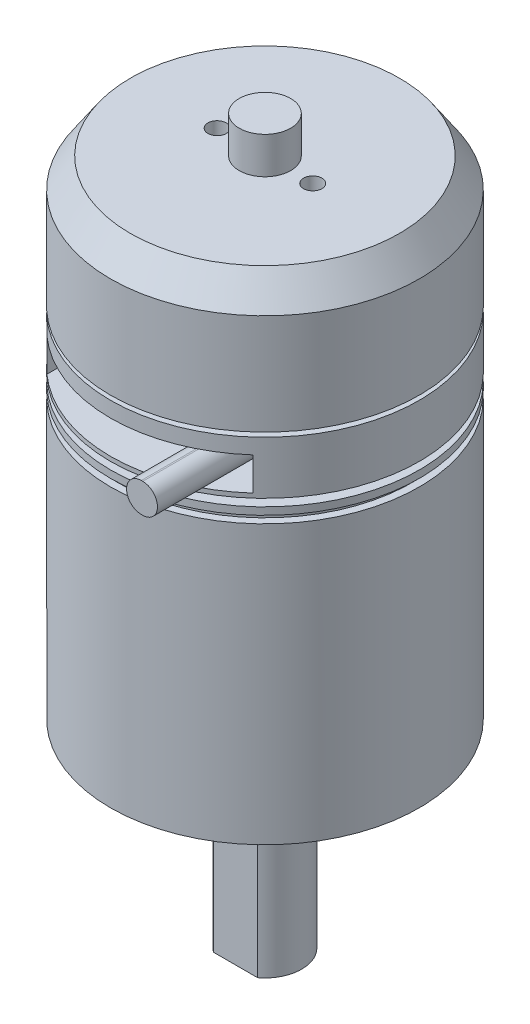
from build123d import *

# Parameters (mm, degrees)
SKETCH_2_W             = 28
SKETCH_2_H             = 4.5
CUT_EXTRUDE_1_DEPTH    = 10
EXTRUDE_1_DEPTH        = 15
HOLE_WIZARD_M3_1_D     = 2.5
HOLE_WIZARD_M3_1_DEPTH = 4
HOLE_WIZARD_M3_1_TIP   = 0.751075774
CUT_EXTRUDE_START      = -20
CUT_EXTRUDE_2_DEPTH    = 20
HOLE_WIZARD_M4_1_D     = 3.3
HOLE_WIZARD_M4_1_DEPTH = 10.1
HOLE_WIZARD_M4_1_TIP   = 0.991420021


with BuildPart() as part:
    # 草图1 → 旋转1 (revolve)
    with BuildSketch(Plane.XY, mode=Mode.PRIVATE) as revolve_1_sk:
        Polygon((0, 0), (4.1, 0), (4.1, 6.7), (13.4, 6.7), (13.4, 8.7), (21, 8.7), (21, 10.2), (20, 10.2), (20, 11.2), (21, 11.2), (21, 12.2), (10, 12.2), (10, 13.2), (21, 13.2), (21, 20.4), (5, 20.4), (5, 21), (21, 21), (21, 34.7), (18.3, 38.7), (3.5, 38.7), (3.5, 43.7), (0, 43.7), align=None)
    revolve(revolve_1_sk.sketch.rotate(Axis((0, 43.7, 0), (0, -1, 0)), 90), axis=Axis((0, 43.7, 0), (0, -1, 0)))

    # 草图2 → 切除-拉伸1 (cut)
    with BuildSketch(Plane.XY.offset(21)):
        with Locations((0, 16.05)):
            Rectangle(SKETCH_2_W, SKETCH_2_H)
    extrude(amount=-CUT_EXTRUDE_1_DEPTH, mode=Mode.SUBTRACT)

    # 草图3 → 凸台-拉伸1 (add)
    with BuildSketch(Plane.XY.offset(11)):
        with BuildLine():
            Line((9.185056323, 18.053194417), (9.385056323, 18.053194417))
            ThreePointArc((9.385056323, 18.053194417), (11.385056323, 16.053194417), (9.385056323, 14.053194417))
            Line((9.385056323, 14.053194417), (9.185056323, 14.053194417))
            ThreePointArc((9.185056323, 14.053194417), (7.185056323, 16.053194417), (9.185056323, 18.053194417))
        make_face()
    extrude(amount=EXTRUDE_1_DEPTH)

    # M3 螺纹孔1
    with Locations(Plane(origin=(0, 38.7, 0), x_dir=(1, 0, 0), z_dir=(0, 1, 0))):
        with Locations((-6.5, 0), (6.5, 0)):
            Hole(HOLE_WIZARD_M3_1_D / 2, depth=HOLE_WIZARD_M3_1_DEPTH)
            with Locations((0, 0, -(HOLE_WIZARD_M3_1_DEPTH + HOLE_WIZARD_M3_1_TIP / 2))):  # 118° drill point
                Cone(0, HOLE_WIZARD_M3_1_D / 2, HOLE_WIZARD_M3_1_TIP, mode=Mode.SUBTRACT)

    # 草图7 → 旋转2 (revolve)
    with BuildSketch(Plane.XY, mode=Mode.PRIVATE) as revolve_2_sk:
        Polygon((0, -54.6), (5, -54.6), (5, -30.5), (8.275, -30.5), (8.275, -29.6), (13, -29.6), (13, -27.6), (21, -27.6), (21, 8.7), (0, 8.7), align=None)
    revolve(revolve_2_sk.sketch.rotate(Axis((0, 8.7, 0), (0, -1, 0)), 180), axis=Axis((0, 8.7, 0), (0, -1, 0)))

    # 草图8 → 切除-拉伸2 (cut)
    with BuildSketch(Plane.XZ.offset(54.6).offset(CUT_EXTRUDE_START)):
        with BuildLine():
            Line((-3, 4), (3, 4))
            ThreePointArc((3, 4), (0, 5), (-3, 4))
        make_face()
    extrude(amount=CUT_EXTRUDE_2_DEPTH, mode=Mode.SUBTRACT)

    # M4 螺纹孔1
    with Locations(Plane(origin=(0, -27.6, 0), x_dir=(-1, 0, 0), z_dir=(0, -1, 0))):
        with Locations((0, -17.5), (-17.5, 0), (0, 17.5), (17.5, 0)):
            Hole(HOLE_WIZARD_M4_1_D / 2, depth=HOLE_WIZARD_M4_1_DEPTH)
            with Locations((0, 0, -(HOLE_WIZARD_M4_1_DEPTH + HOLE_WIZARD_M4_1_TIP / 2))):  # 118° drill point
                Cone(0, HOLE_WIZARD_M4_1_D / 2, HOLE_WIZARD_M4_1_TIP, mode=Mode.SUBTRACT)


solid = part.part
